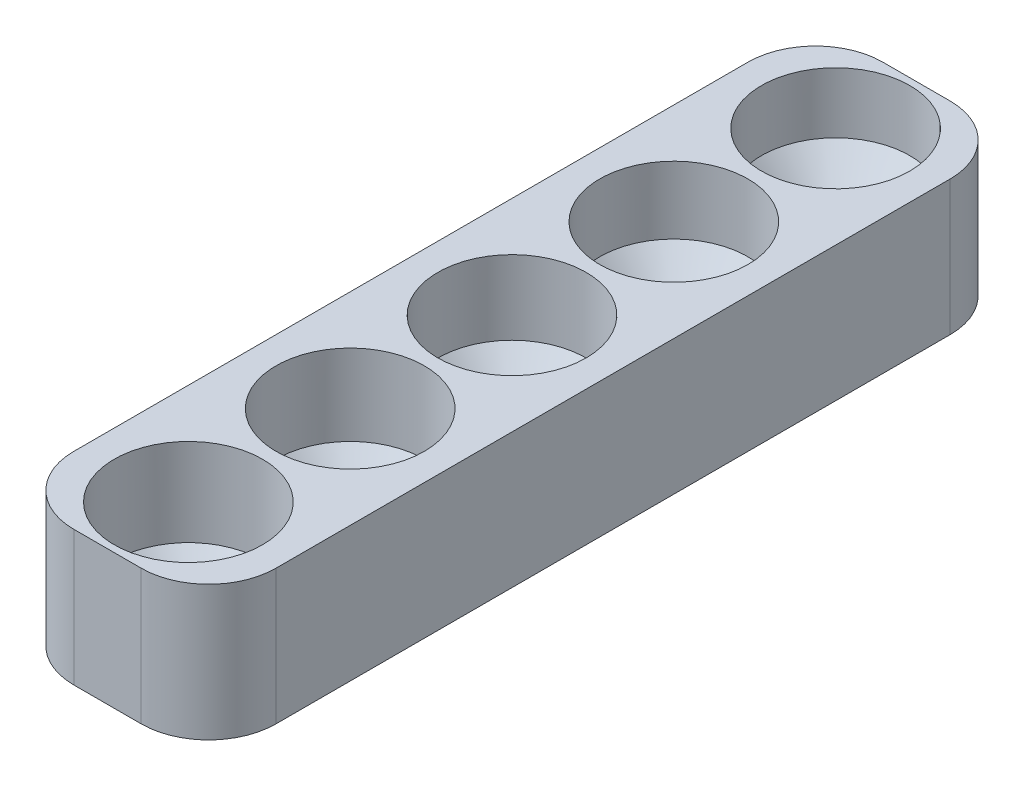
from build123d import *

# Parameters (mm, degrees)
BOSS_EXTRUDE1_DEPTH      = 60
BOSS_EXTRUDE1_DEPTH_BACK = 60
SKETCH2_W                = 30
SKETCH2_H                = 20
FILLET1_R                = 10


with BuildPart() as part:
    # Sketch1 → Revolve1 (revolve)
    with BuildSketch(Plane(origin=(0, 0, 0), x_dir=(0, 0, -1), z_dir=(1, 0, 0))):
        Polygon((0, 40.5), (0, 0), (11, 12), (11, 39.586753314), (10.816971936, 39.157197652), (10.816971936, 42.5), (0, 42.5), align=None)
    revolve(axis=Axis((0, 0, 0), (0, 1, 0)))


with BuildPart() as body_2:
    # Sketch1<3> → Revolve2 (revolve)
    with BuildSketch(Plane(origin=(0, 0, 0), x_dir=(0, 0, -1), z_dir=(1, 0, 0))):
        Polygon((24, 41.5), (24, 1), (35, 13), (35, 40.586753314), (35.621275123, 42.044847991), (35.621275123, 42.5), (24, 42.5), align=None)
    revolve(axis=Axis((0, 1, -24), (0, 1, 0)))


with BuildPart() as body_3:
    # Sketch1<4> → Revolve3 (revolve)
    with BuildSketch(Plane(origin=(0, 0, 0), x_dir=(0, 0, -1), z_dir=(1, 0, 0))):
        Polygon((48, 42.5), (48, 2), (59, 14), (59, 41.586753314), (59.389122501, 42.5), align=None)
    revolve(axis=Axis((0, 2, -48), (0, 1, 0)))


with BuildPart() as body_4:
    # Sketch1<5> → Revolve4 (revolve)
    with BuildSketch(Plane(origin=(0, 0, 0), x_dir=(0, 0, -1), z_dir=(1, 0, 0))):
        Polygon((-24, 39.501916964), (-24, -0.998083036), (-13, 11.001916964), (-13, 38.588670277), (-12.993341541, 38.604297273), (-12.993341541, 42.5), (-24, 42.5), align=None)
    revolve(axis=Axis((0, -0.998083036, 24), (0, 1, 0)))


with BuildPart() as body_5:
    # Sketch1<6> → Revolve5 (revolve)
    with BuildSketch(Plane(origin=(0, 0, 0), x_dir=(0, 0, -1), z_dir=(1, 0, 0))):
        Polygon((-48, 38.503833927), (-48, -1.996166073), (-37, 10.003833927), (-37, 37.590587241), (-36.686033209, 38.327448077), (-36.686033209, 42.5), (-48, 42.5), align=None)
    revolve(axis=Axis((0, -1.996166073, 48), (0, 1, 0)))


with BuildPart() as body_6:
    # Sketch2 → Boss-Extrude1 (new, two sides: drawn at the far end of the back side and taken through both)
    with BuildSketch(Plane.XY.offset(-BOSS_EXTRUDE1_DEPTH_BACK)):
        with Locations((0, 13)):
            Rectangle(SKETCH2_W, SKETCH2_H)
    extrude(amount=BOSS_EXTRUDE1_DEPTH + BOSS_EXTRUDE1_DEPTH_BACK)

    # Combine1: cut part, body 5, body 2, body 3, body 4
    add(part.part, mode=Mode.SUBTRACT)
    add(body_5.part, mode=Mode.SUBTRACT)
    add(body_2.part, mode=Mode.SUBTRACT)
    add(body_3.part, mode=Mode.SUBTRACT)
    add(body_4.part, mode=Mode.SUBTRACT)

    # Fillet1
    fillet1_edges = [body_6.edges().sort_by_distance(p)[0] for p in [
        (-15, 13, -60),
        (15, 13, -60),
        (15, 13, 60),
        (-15, 13, 60),
    ]]
    fillet(fillet1_edges, radius=FILLET1_R)


solid = body_6.part
